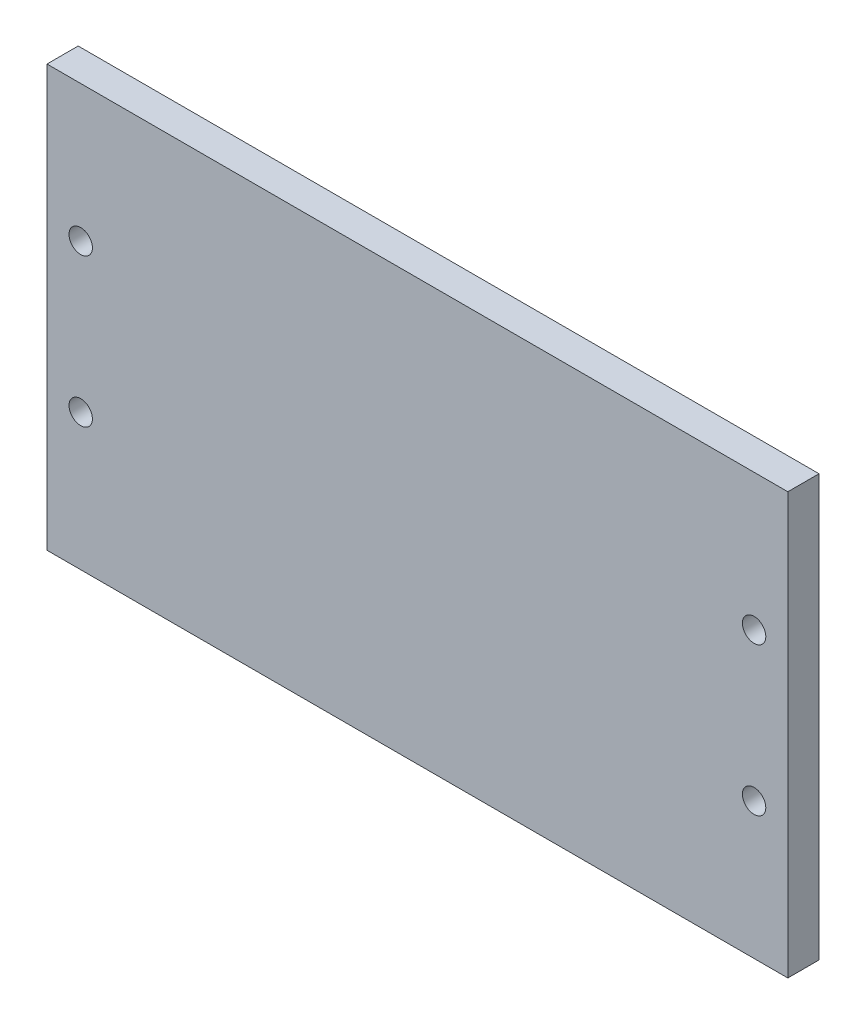
from build123d import *

# Parameters (mm, degrees)
SKETCH1_W           = 190
SKETCH1_H           = 108
BOSS_EXTRUDE1_DEPTH = 8
SKETCH2_R           = 3
CUT_EXTRUDE1_DEPTH  = 110.567330897


with BuildPart() as part:
    # Sketch1 → Boss-Extrude1 (new body)
    with BuildSketch(Plane.XY):
        Rectangle(SKETCH1_W, SKETCH1_H)
    extrude(amount=BOSS_EXTRUDE1_DEPTH)

    # Sketch2 → Cut-Extrude1 (cut, through all)
    with BuildSketch(Plane.XY.offset(8)):
        with Locations((-86.35, -19)):
            Circle(SKETCH2_R)
        with Locations((86.35, -19)):
            Circle(SKETCH2_R)
        with Locations((86.35, 19)):
            Circle(SKETCH2_R)
        with Locations((-86.35, 19)):
            Circle(SKETCH2_R)
    extrude(amount=-CUT_EXTRUDE1_DEPTH, mode=Mode.SUBTRACT)


solid = part.part
